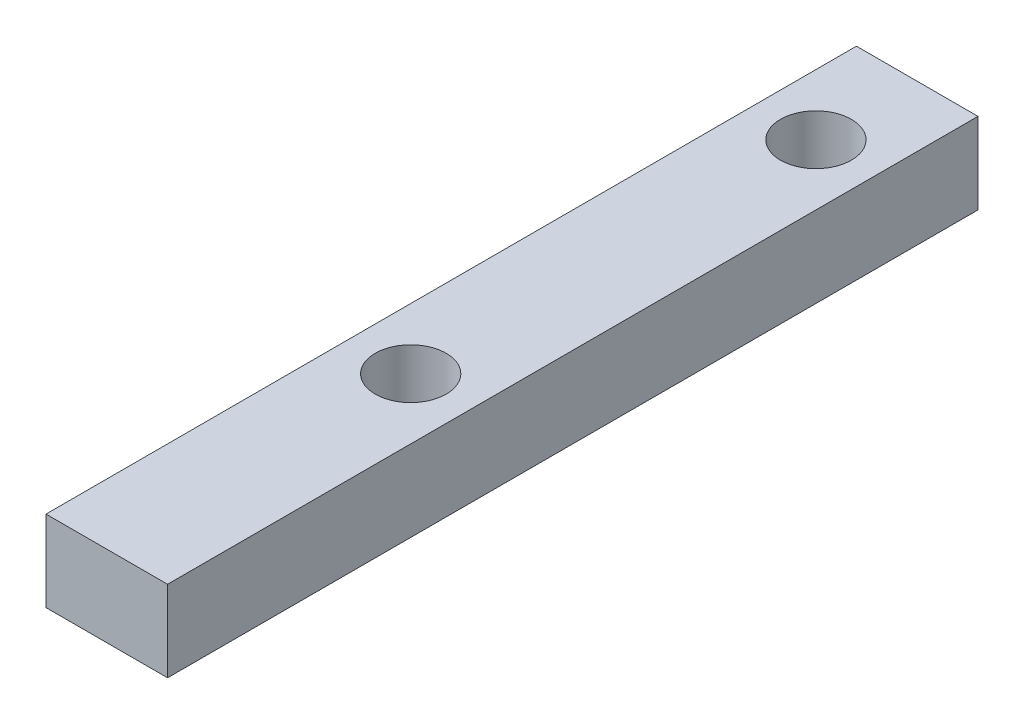
from build123d import *

# Parameters (mm, degrees)
SKETCH_1_W      = 6
SKETCH_1_H      = 40
SKETCH_1_R      = 1.75
EXTRUDE_1_DEPTH = 4


with BuildPart() as part:
    # 草图1 → 凸台-拉伸1 (new body)
    with BuildSketch(Plane(origin=(0, 0, 0), x_dir=(1, 0, 0), z_dir=(0, 1, 0))):
        Rectangle(SKETCH_1_W, SKETCH_1_H)
        with Locations(Location((0, 15, 0), (0, 0, 270))):
            Circle(SKETCH_1_R, mode=Mode.SUBTRACT)
        with Locations(Location((0, -5, 0), (0, 0, 270))):
            Circle(SKETCH_1_R, mode=Mode.SUBTRACT)
    extrude(amount=EXTRUDE_1_DEPTH)


solid = part.part
